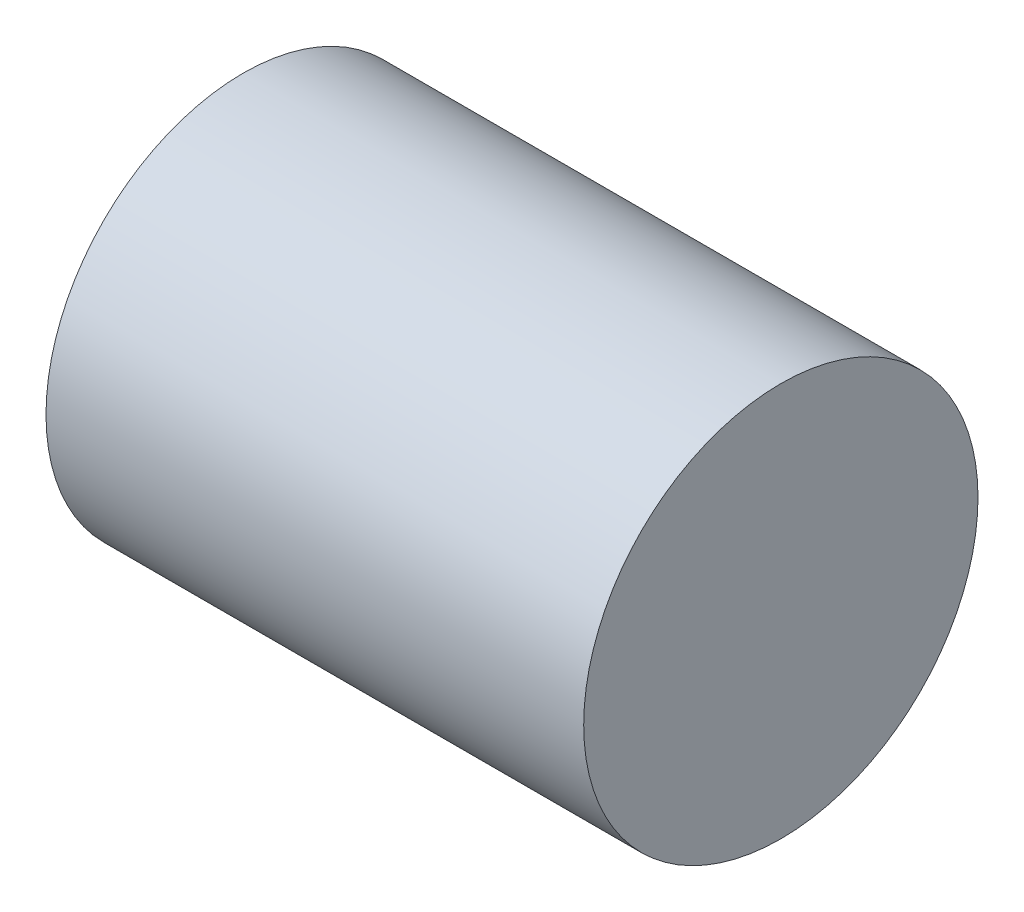
from build123d import *

# Parameters (mm, degrees)
SKETCH1_R           = 5.5
BOSS_EXTRUDE1_DEPTH = 15


with BuildPart() as part:
    # Sketch1 → Boss-Extrude1 (new body)
    with BuildSketch(Plane.YZ):
        with Locations(Location((0, 0, 0), (0, 0, 270))):
            Circle(SKETCH1_R)
    extrude(amount=BOSS_EXTRUDE1_DEPTH)


solid = part.part
